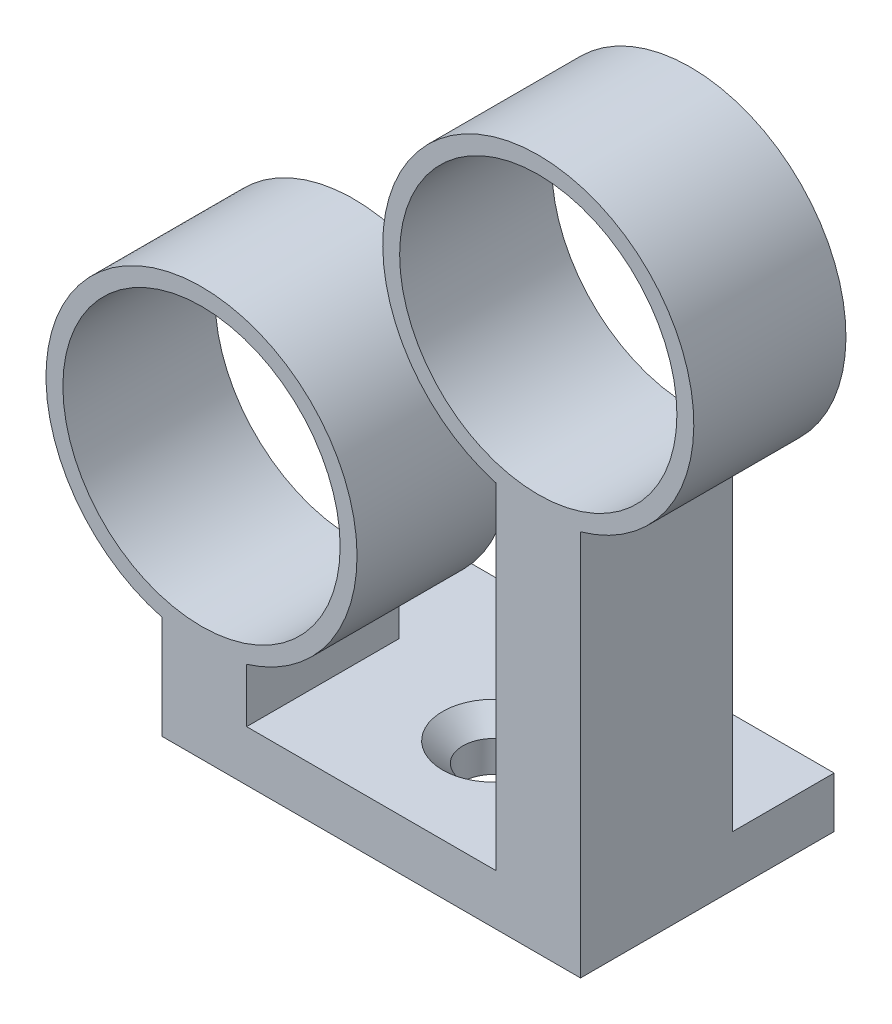
from build123d import *

# Parameters (mm, degrees)
SKETCH1_R             = 9.2
SKETCH1_R_2           = 8.2
BOSS_EXTRUDE1_DEPTH   = 9
BOSS_EXTRUDE1_2_DEPTH = 9
BOSS_EXTRUDE2_DEPTH   = 9
SKETCH3_W             = 24.749470463
SKETCH3_H             = 15
BOSS_EXTRUDE3_DEPTH   = 3


with BuildPart() as part:
    # Sketch1 → Boss-Extrude1 (new body)
    with BuildSketch(Plane.XY):
        with Locations((22.544450453, 56.532786317)):
            Circle(SKETCH1_R)
        with Locations((22.544450453, 56.532786317)):
            Circle(SKETCH1_R_2, mode=Mode.SUBTRACT)
    extrude(amount=BOSS_EXTRUDE1_DEPTH)



with BuildPart() as body_2:
    # Sketch1 → Boss-Extrude1 2 (new body)
    with BuildSketch(Plane.XY):
        with Locations((2.62521603, 39.822786317)):
            Circle(SKETCH1_R)
        with Locations((2.62521603, 39.822786317)):
            Circle(SKETCH1_R_2, mode=Mode.SUBTRACT)
    extrude(amount=BOSS_EXTRUDE1_2_DEPTH)


with BuildPart() as part_1:
    add(part.part)

    add(body_2.part)  # Boss-Extrude2 merges body 2
    # Sketch2 → Boss-Extrude2 (add)
    with BuildSketch(Plane.XY):
        with BuildLine():
            Line((0.29497999, 24.822786317), (5.29497999, 24.822786317))
            Line((5.29497999, 24.822786317), (5.29497999, 31.018675891))
            ThreePointArc((5.29497999, 31.018675891), (2.801620408, 30.624477696), (0.29497999, 30.922786317))
            Line((0.29497999, 30.922786317), (0.29497999, 24.822786317))
        make_face()
        with BuildLine():
            Line((20.044450453, 47.722786317), (20.044450453, 24.822786317))
            Line((20.044450453, 24.822786317), (25.044450453, 24.822786317))
            Line((25.044450453, 24.822786317), (25.044450453, 47.722786317))
            ThreePointArc((25.044450453, 47.722786317), (22.544450453, 47.332786317), (20.044450453, 47.722786317))
        make_face()
    extrude(amount=BOSS_EXTRUDE2_DEPTH)

    # Sketch3 → Boss-Extrude3 (add)
    with BuildSketch(Plane.XZ.offset(-24.822786317)):
        with Locations((12.669715222, 1.5)):
            Rectangle(SKETCH3_W, SKETCH3_H)
    extrude(amount=-BOSS_EXTRUDE3_DEPTH)

    # Sketch5 → Avellanado para tornillo con cabeza avellanada en cruz de M31 (revolve, cut)
    with BuildSketch(Plane(origin=(13.312105777, 27.822786317, 2.425807985), x_dir=(0, 0, 1), z_dir=(1, 0, 0))):
        Polygon((0, 0), (0, 11.081549114), (1.8, 10), (1.8, 1.15882653), (3, 0), align=None)
    revolve(axis=Axis((13.312105777, 34.172786317, 2.425807985), (0, -1, 0)), mode=Mode.SUBTRACT)


solid = part_1.part
